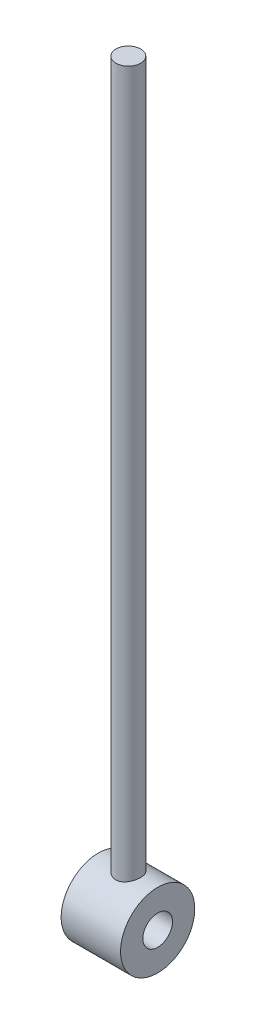
from build123d import *

# Parameters (mm, degrees)
SKETCH_1_R          = 7.5
EXTRUDE_1_DEPTH     = 12
SKETCH_3_R          = 2.5
EXTRUDE_2_DEPTH     = 150
CUT_EXTRUDE_1_REACH = 152.666
SKETCH_2_R          = 3


with BuildPart() as part:
    # 草图1 → 凸台-拉伸1 (new body)
    with BuildSketch(Plane(origin=(0, 0, 0), x_dir=(0, 0, -1), z_dir=(1, 0, 0))):
        Circle(SKETCH_1_R)
    extrude(amount=EXTRUDE_1_DEPTH)

    # 草图3 → 凸台-拉伸2 (add)
    with BuildSketch(Plane(origin=(0, 0, 0), x_dir=(1, 0, 0), z_dir=(0, 1, 0))):
        with Locations(Location((6.065609695, 0, 0), (0, 0, 90))):
            Circle(SKETCH_3_R)
    extrude(amount=EXTRUDE_2_DEPTH)

    # 草图2 → 切除-拉伸1 (cut, up to next)
    with BuildSketch(Plane(origin=(12, 0, 0), x_dir=(0, 0, -1), z_dir=(1, 0, 0)), mode=Mode.PRIVATE) as cut_extrude_1_sk1:
        Circle(SKETCH_2_R)
    cut_extrude_1_tool1 = extrude(cut_extrude_1_sk1.sketch, amount=-CUT_EXTRUDE_1_REACH, mode=Mode.PRIVATE) & part.part
    add(cut_extrude_1_tool1.solids().sort_by_distance((12, 0, 0))[0], mode=Mode.SUBTRACT)


solid = part.part
